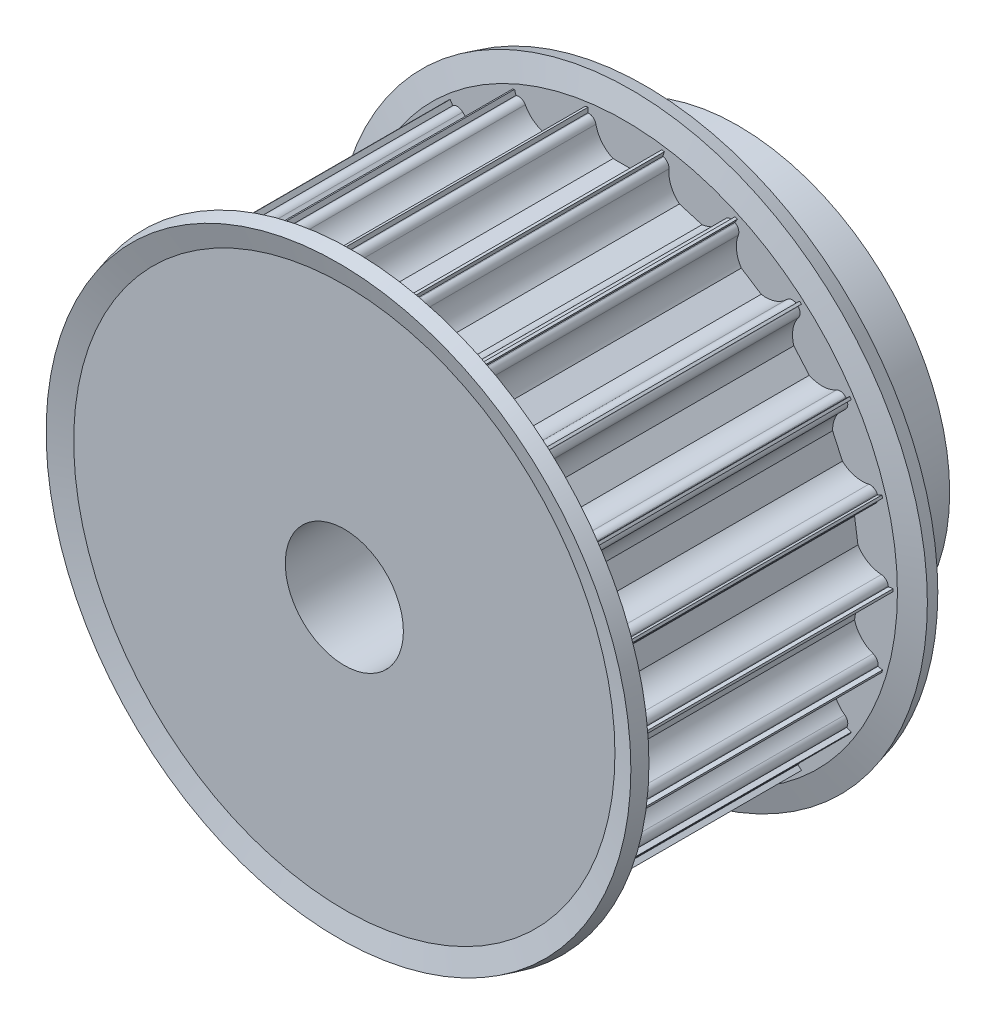
from build123d import *

# Parameters (mm, degrees)
CUT_EXTRUDE1_DEPTH = 56.543901555
CIRPATTERN1_COUNT  = 22


with BuildPart() as part:
    # Sketch1 → Revolve1 (revolve)
    with BuildSketch(Plane(origin=(0, 0, 0), x_dir=(0, 0, -1), z_dir=(1, 0, 0)), mode=Mode.PRIVATE) as revolve1_sk:
        Polygon((0, 6), (0, 27.25), (30, 27.25), (30, 21.5), (40, 21.5), (40, 6), align=None)
    revolve(revolve1_sk.sketch.rotate(Axis((0, 0, 29.536098978), (0, 0, -1)), 90), axis=Axis((0, 0, 29.536098978), (0, 0, -1)))

    # Sketch2 → Cut-Extrude1 (cut, through all)
    with BuildSketch(Plane.XY):
        with BuildLine():
            Line((3.674234614, 26.5), (3.75, 26.5))
            Line((3.75, 26.5), (3.75, 28.5))
            Line((3.75, 28.5), (-3.75, 28.5))
            Line((-3.75, 28.5), (-3.75, 26.5))
            Line((-3.75, 26.5), (-3.674234614, 26.5))
            ThreePointArc((-3.674234614, 26.5), (-3.199892965, 26.330947502), (-2.939387691, 25.9))
            ThreePointArc((-2.939387691, 25.9), (-2.331759211, 24.612435701), (-1.198957881, 23.75))
            Line((-1.198957881, 23.75), (1.198957881, 23.75))
            ThreePointArc((1.198957881, 23.75), (2.331759211, 24.612435701), (2.939387691, 25.9))
            ThreePointArc((2.939387691, 25.9), (3.199892965, 26.330947502), (3.674234614, 26.5))
        make_face()
    cut_extrude1 = extrude(amount=-CUT_EXTRUDE1_DEPTH, mode=Mode.SUBTRACT)

    # CirPattern1: Cut-Extrude1 ×22 about axis
    cirpattern1_axis = Axis((0, 0, 0), (0, 0, 1))
    for i in range(1, CIRPATTERN1_COUNT):
        add(cut_extrude1.rotate(cirpattern1_axis, i * 360 / CIRPATTERN1_COUNT), mode=Mode.SUBTRACT)

    # Sketch4 → Revolve2 (revolve)
    with BuildSketch(Plane(origin=(0, 0, 0), x_dir=(0, 0, -1), z_dir=(1, 0, 0)), mode=Mode.PRIVATE) as revolve2_sk:
        Polygon((-0.591966801, 29.702510585), (0, 27.493260406), (0, 22.690739153), (1.5, 22.690739153), (1.5, 27.690739153), (0.856921938, 30.090739153), align=None)
        Polygon((30.591966801, 29.702510585), (29.143078062, 30.090739153), (28.5, 27.690739153), (28.5, 22.690739153), (30, 22.690739153), (30, 27.493260406), align=None)
    revolve(revolve2_sk.sketch.rotate(Axis((0, 0, 21.209859057), (0, 0, -1)), 90), axis=Axis((0, 0, 21.209859057), (0, 0, -1)))


solid = part.part
